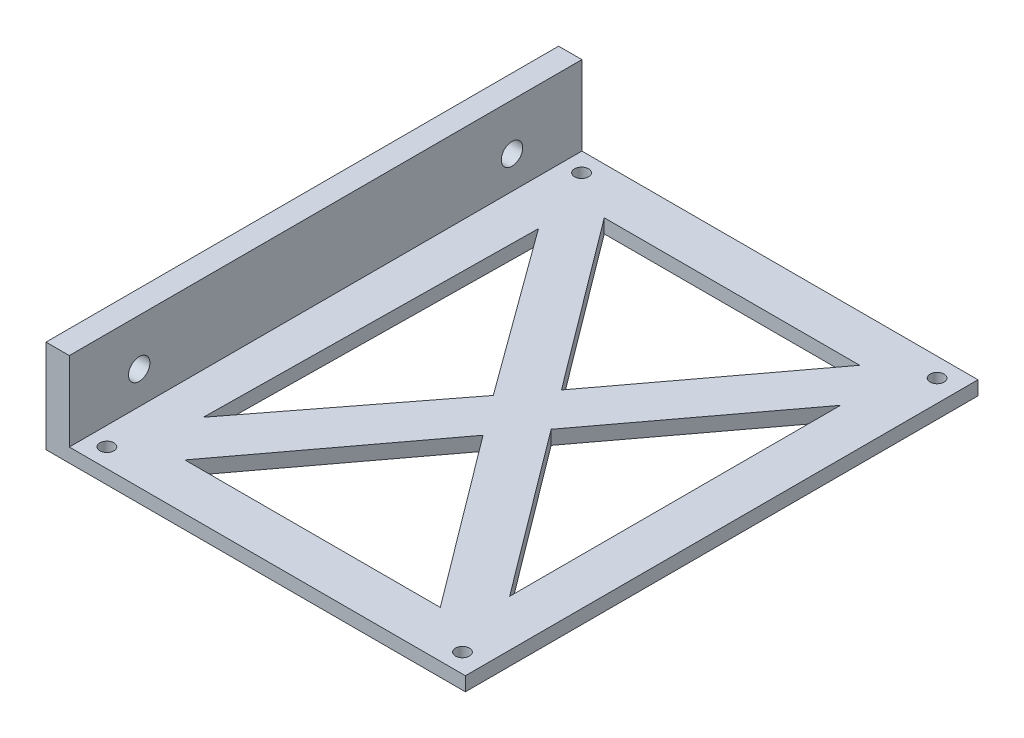
from build123d import *

# Parameters (mm, degrees)
SKETCH2_W           = 110
SKETCH2_H           = 20
BOSS_EXTRUDE1_DEPTH = 5
SKETCH3_W           = 85
SKETCH3_H           = 110
BOSS_EXTRUDE2_DEPTH = 3
SKETCH4_R           = 2.3
CUT_EXTRUDE2_DEPTH  = 10
SKETCH5_R           = 1.498794896
CUT_EXTRUDE3_DEPTH  = 10
CUT_EXTRUDE4_DEPTH  = 10


with BuildPart() as part:
    # Sketch2 → Boss-Extrude1 (new body)
    with BuildSketch(Plane(origin=(0, 0, 0), x_dir=(0, 0, -1), z_dir=(1, 0, 0))):
        Rectangle(SKETCH2_W, SKETCH2_H)
    extrude(amount=BOSS_EXTRUDE1_DEPTH)

    # Sketch3 → Boss-Extrude2 (add)
    with BuildSketch(Plane(origin=(0, -10, 0), x_dir=(1, 0, 0), z_dir=(0, 1, 0))):
        with Locations((47.5, 0)):
            Rectangle(SKETCH3_W, SKETCH3_H)
    extrude(amount=BOSS_EXTRUDE2_DEPTH)

    # Sketch4 → Cut-Extrude2 (cut)
    with BuildSketch(Plane(origin=(0, 0, 0), x_dir=(0, 0, -1), z_dir=(1, 0, 0))):
        with Locations(Location((40, 0, 0), (0, 0, 180))):
            Circle(SKETCH4_R)
        with Locations(Location((-40, 0, 0), (0, 0, 180))):
            Circle(SKETCH4_R)
    extrude(amount=CUT_EXTRUDE2_DEPTH, mode=Mode.SUBTRACT)

    # Sketch5 → Cut-Extrude3 (cut)
    with BuildSketch(Plane.XZ.offset(10)):
        with Locations(Location((9, 50.925, 0), (0, 0, 270))):
            Circle(SKETCH5_R)
        with Locations(Location((85.3, 50.925, 0), (0, 0, 270))):
            Circle(SKETCH5_R)
        with Locations(Location((85.3, -50.925, 0), (0, 0, 270))):
            Circle(SKETCH5_R)
        with Locations(Location((9, -50.925, 0), (0, 0, 270))):
            Circle(SKETCH5_R)
    extrude(amount=-CUT_EXTRUDE3_DEPTH, mode=Mode.SUBTRACT)

    # Sketch6 → Cut-Extrude4 (cut)
    with BuildSketch(Plane(origin=(0, -7, 0), x_dir=(1, 0, 0), z_dir=(0, 1, 0))):
        Polygon((80, 35.510778555), (53.397423626, 0), (80, -35.510778555), align=None)
        Polygon((40.903082344, 0.079509445), (13.850723409, -35.089828613), (14.754597533, 35.925976571), align=None)
        Polygon((19.79313121, 45), (47.203523895, 8.410897837), (74.613916581, 45), align=None)
        Polygon((47.203523895, -8.410897837), (74.613916581, -45), (19.79313121, -45), align=None)
    extrude(amount=-CUT_EXTRUDE4_DEPTH, mode=Mode.SUBTRACT)


solid = part.part
